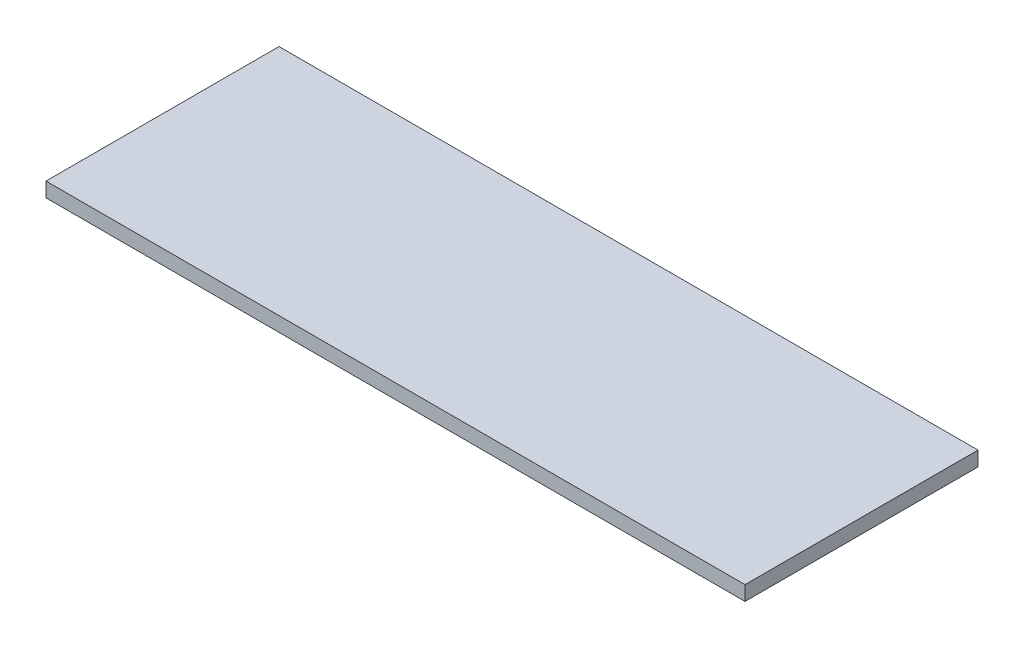
from build123d import *

# Parameters (mm, degrees)
SKETCH1_W           = 609.6
SKETCH1_H           = 203.2
BOSS_EXTRUDE1_DEPTH = 12.7


with BuildPart() as part:
    # Sketch1 → Boss-Extrude1 (new body)
    with BuildSketch(Plane(origin=(0, 0, 0), x_dir=(1, 0, 0), z_dir=(0, 1, 0))):
        Rectangle(SKETCH1_W, SKETCH1_H)
    extrude(amount=BOSS_EXTRUDE1_DEPTH)


solid = part.part
